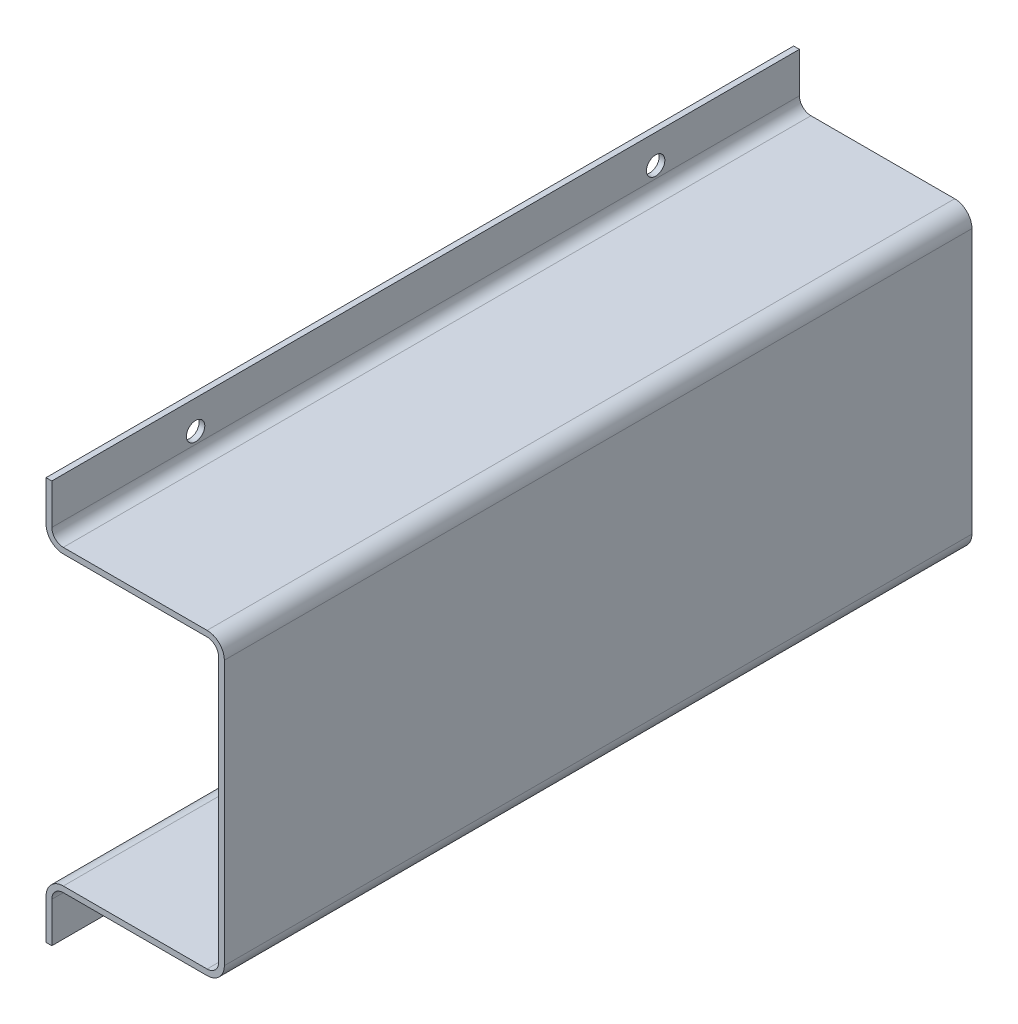
from build123d import *

# Parameters (mm, degrees)
EXTRUDE_1_DEPTH             = 130
HOLE_WIZARD_M3_2_AT_2_COUNT = 2
HOLE_WIZARD_M3_2_AT_2_PITCH = 80


with BuildPart() as part:
    # ｽｹｯﾁ1 → ﾎﾞｽ - 押し出し1 (new body)
    with BuildSketch(Plane.XY):
        with BuildLine():
            Line((0, 35), (0, 28))
            ThreePointArc((0, 28), (0.878679656, 25.878679656), (3, 25))
            Line((3, 25), (28, 25))
            ThreePointArc((28, 25), (29.414213562, 24.414213562), (30, 23))
            Line((30, 23), (30, 0))
            Line((30, 0), (31, 0))
            Line((31, 0), (31, 23))
            ThreePointArc((31, 23), (30.121320344, 25.121320344), (28, 26))
            Line((28, 26), (3, 26))
            ThreePointArc((3, 26), (1.585786438, 26.585786438), (1, 28))
            Line((1, 28), (1, 35))
            Line((1, 35), (0, 35))
        make_face()
    extrude_1 = extrude(amount=EXTRUDE_1_DEPTH)

    # ｽｹｯﾁ5 → M3 すきま穴2 (revolve, cut)
    with BuildSketch(Plane(origin=(1, 30, 25), x_dir=(0, 0, -1), z_dir=(0, 1, 0))):
        Polygon((0, 0), (0, 10.96137699), (1.6, 10), (1.6, 0), align=None)
    hole_wizard_m3_2 = revolve(axis=Axis((7.35, 30, 25), (-1, 0, 0)), mode=Mode.SUBTRACT)

    # M3 すきま穴2 at 2: M3 すきま穴2 ×2
    with Locations(*[(0, 0, i * HOLE_WIZARD_M3_2_AT_2_PITCH) for i in range(1, HOLE_WIZARD_M3_2_AT_2_COUNT)]):
        add(hole_wizard_m3_2, mode=Mode.SUBTRACT)

    # ﾐﾗｰ2: ﾎﾞｽ - 押し出し1, M3 すきま穴2 across plane
    add(extrude_1.mirror(Plane.ZX))
    add(hole_wizard_m3_2.mirror(Plane.ZX), mode=Mode.SUBTRACT)

    # ﾐﾗｰ2 copy 1 sketch → ﾐﾗｰ2 copy 1 (revolve, cut)
    with BuildSketch(Plane(origin=(1, -30, 105), x_dir=(0, 0, -1), z_dir=(0, -1, 0))):
        Polygon((0, 0), (0, -10.96137699), (1.6, -10), (1.6, 0), align=None)
    revolve(axis=Axis((7.35, -30, 105), (1, 0, 0)), mode=Mode.SUBTRACT)


solid = part.part
